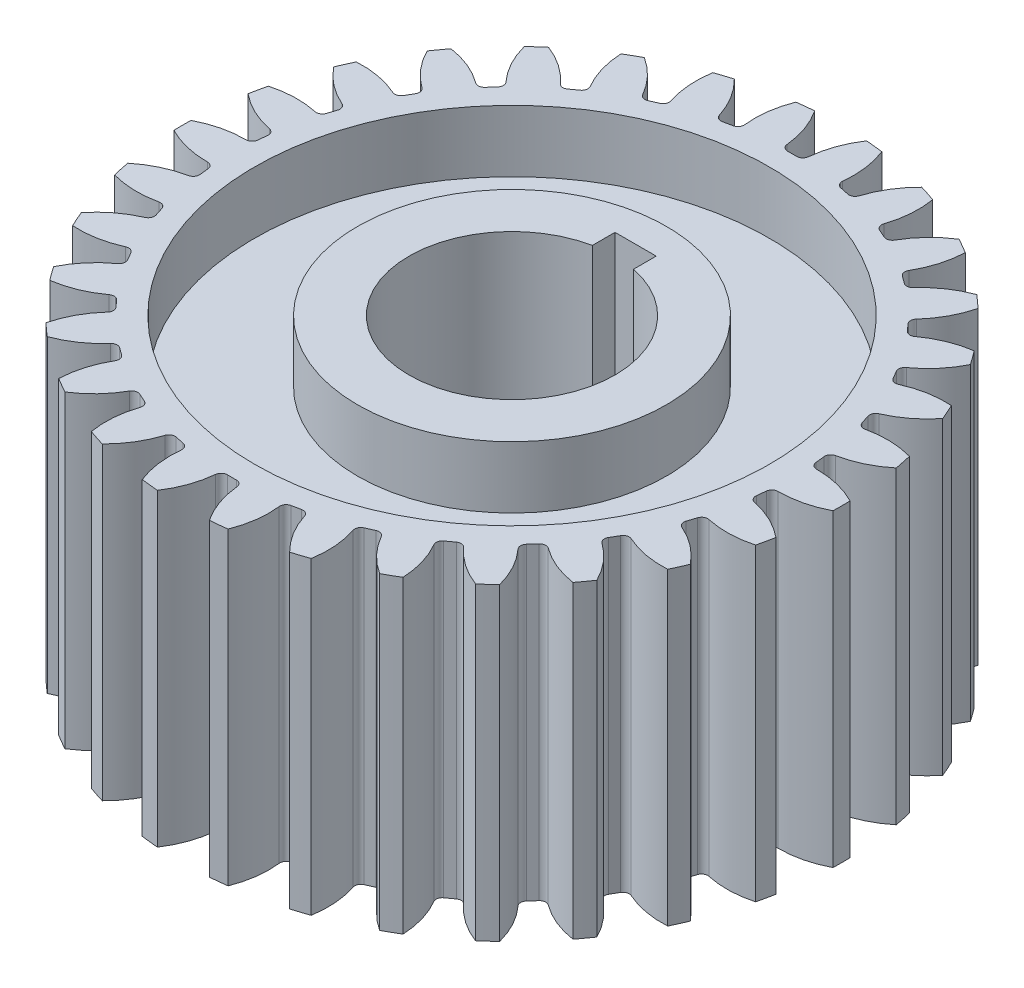
from build123d import *

# Parameters (mm, degrees)
SKETCH1_R           = 16
BOSS_EXTRUDE1_DEPTH = 7.5
CUT_EXTRUDE1_DEPTH  = 28.147743921
SKETCH3_R           = 12.5
SKETCH3_R_2         = 7.5
CUT_EXTRUDE2_DEPTH  = 3
CUT_EXTRUDE4_DEPTH  = 28.147743921
CIRPATTERN1_COUNT   = 30


with BuildPart() as part:
    # Sketch1 → Boss-Extrude1 (new, symmetric)
    with BuildSketch(Plane(origin=(0, 0, 0), x_dir=(1, 0, 0), z_dir=(0, 1, 0))):
        Circle(SKETCH1_R)
    extrude(amount=BOSS_EXTRUDE1_DEPTH, both=True)

    # Sketch2 → Cut-Extrude1 (cut, through all)
    with BuildSketch(Plane(origin=(0, 7.5, 0), x_dir=(1, 0, 0), z_dir=(0, 1, 0))):
        with BuildLine():
            Line((-1, 6), (1, 6))
            Line((1, 6), (1, 4.898979486))
            ThreePointArc((1, 4.898979486), (0, -5), (-1, 4.898979486))
            Line((-1, 4.898979486), (-1, 6))
        make_face()
    extrude(amount=-CUT_EXTRUDE1_DEPTH, mode=Mode.SUBTRACT)

    # Sketch3 → Cut-Extrude2 (cut)
    with BuildSketch(Plane(origin=(0, 7.5, 0), x_dir=(1, 0, 0), z_dir=(0, 1, 0))):
        Circle(SKETCH3_R)
        Circle(SKETCH3_R_2, mode=Mode.SUBTRACT)
    cut_extrude2 = extrude(amount=-CUT_EXTRUDE2_DEPTH, mode=Mode.SUBTRACT)

    # Mirror1: Cut-Extrude2 across plane
    add(cut_extrude2.mirror(Plane.ZX), mode=Mode.SUBTRACT)

    # Sketch4 → Cut-Extrude4 (cut, through all)
    with BuildSketch(Plane(origin=(0, 7.5, 0), x_dir=(1, 0, 0), z_dir=(0, 1, 0))):
        with BuildLine():
            Line((-0.219874756, 13.6), (0.219874756, 13.6))
            ThreePointArc((0.219874756, 13.6), (0.421386888, 13.677754953), (0.518441911, 13.870714262))
            ThreePointArc((0.518441911, 13.870714262), (1.009154991, 15.525876188), (2.08, 16.88))
            ThreePointArc((2.08, 16.88), (0, 17.000581665), (-2.08, 16.88))
            ThreePointArc((-2.08, 16.88), (-1.009154991, 15.525876188), (-0.518441911, 13.870714262))
            ThreePointArc((-0.518441911, 13.870714262), (-0.421386888, 13.677754953), (-0.219874756, 13.6))
        make_face()
    cut_extrude4 = extrude(amount=-CUT_EXTRUDE4_DEPTH, mode=Mode.SUBTRACT)

    # CirPattern1: Cut-Extrude4 ×30 about axis
    cirpattern1_axis = Axis((0, 4.5, 0), (0, 1, 0))
    for i in range(1, CIRPATTERN1_COUNT):
        add(cut_extrude4.rotate(cirpattern1_axis, i * 360 / CIRPATTERN1_COUNT), mode=Mode.SUBTRACT)


solid = part.part
